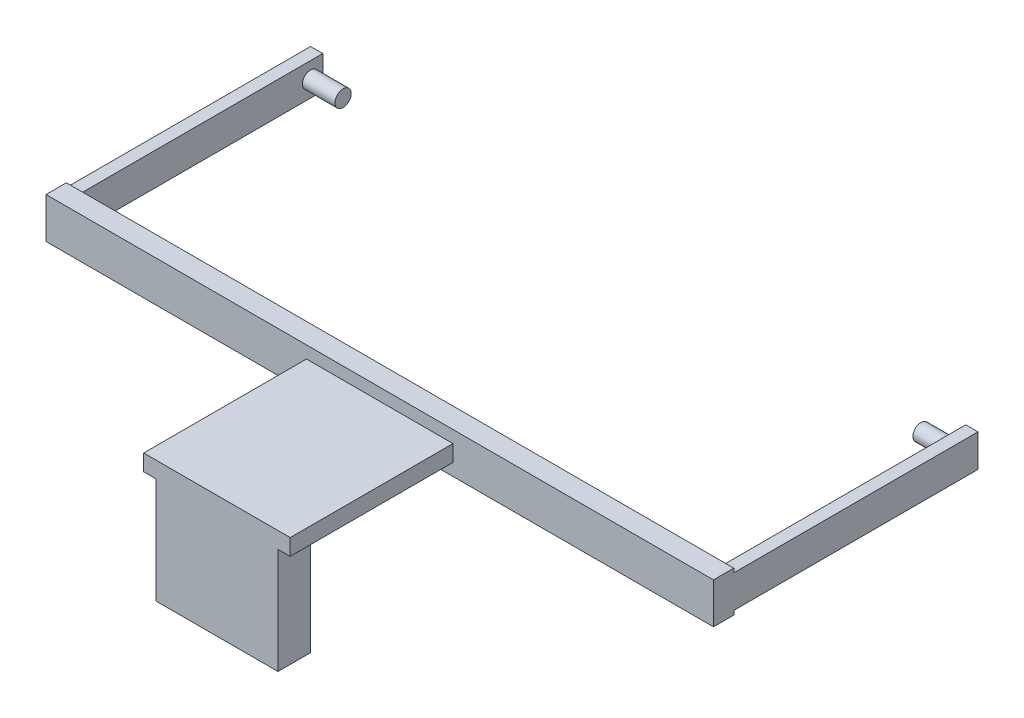
from build123d import *

# Parameters (mm, degrees)
SKETCH_1_W             = 164
SKETCH_1_H             = 5
EXTRUDE_1_DEPTH        = 10
SKETCH_2_W             = 3
SKETCH_2_H             = 8
EXTRUDE_2_DEPTH        = 60
PATTERN_LINEAR_1_COUNT = 2
PATTERN_LINEAR_1_PITCH = 161
SKETCH_4_R             = 2
EXTRUDE_3_DEPTH        = 8
EXTRUDE_START          = 8
SKETCH_5_R             = 2
EXTRUDE_4_DEPTH        = 8
SKETCH_6_W             = 36
SKETCH_6_H             = 4
EXTRUDE_5_DEPTH        = 40
SKETCH_7_W             = 30
SKETCH_7_H             = 8
EXTRUDE_6_DEPTH        = 26


with BuildPart() as part:
    # 草图1 → 凸台-拉伸1 (new body)
    with BuildSketch(Plane(origin=(0, 0, 0), x_dir=(1, 0, 0), z_dir=(0, 1, 0))):
        Rectangle(SKETCH_1_W, SKETCH_1_H)
    extrude(amount=EXTRUDE_1_DEPTH)

    # 草图2 → 凸台-拉伸2 (add)
    with BuildSketch(Plane(origin=(0, 0, -2.5), x_dir=(-1, 0, 0), z_dir=(0, 0, -1))):
        with Locations((-80.5, 5)):
            Rectangle(SKETCH_2_W, SKETCH_2_H)
    extrude_2 = extrude(amount=EXTRUDE_2_DEPTH)

    # 阵列(线性)1: 凸台-拉伸2 ×2
    with Locations(*[(-i * PATTERN_LINEAR_1_PITCH, 0, 0) for i in range(1, PATTERN_LINEAR_1_COUNT)]):
        add(extrude_2)

    # 草图4 → 凸台-拉伸3 (add)
    with BuildSketch(Plane(origin=(-79, 0, 0), x_dir=(0, 0, -1), z_dir=(1, 0, 0))):
        with Locations(Location((59.5, 5, 0), (0, 0, 180))):
            Circle(SKETCH_4_R)
    extrude(amount=EXTRUDE_3_DEPTH)

    # 草图5 → 凸台-拉伸4 (add)
    with BuildSketch(Plane.ZY.offset(-79).offset(EXTRUDE_START)):
        with Locations((-59.5, 5)):
            Circle(SKETCH_5_R)
    extrude(amount=-EXTRUDE_4_DEPTH)

    # 草图6 → 凸台-拉伸5 (add)
    with BuildSketch(Plane.XY.offset(2.5)):
        with Locations((0, 5)):
            Rectangle(SKETCH_6_W, SKETCH_6_H)
    extrude(amount=EXTRUDE_5_DEPTH)

    # 草图7 → 凸台-拉伸6 (add)
    with BuildSketch(Plane.XZ.offset(-3)):
        with Locations((0, 38.5)):
            Rectangle(SKETCH_7_W, SKETCH_7_H)
    extrude(amount=EXTRUDE_6_DEPTH)


solid = part.part
